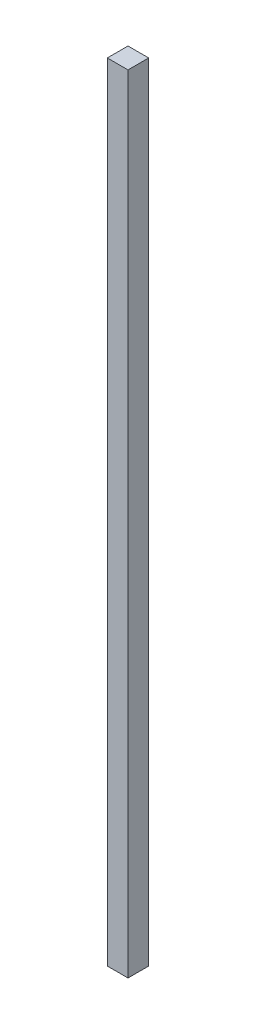
from build123d import *

# Parameters (mm, degrees)
SKETCH_1_W      = 50
SKETCH_1_H      = 50
EXTRUDE_1_DEPTH = 1900


with BuildPart() as part:
    # Эскиз1 → Бобышка-Вытянуть1 (new body)
    with BuildSketch(Plane(origin=(0, 0, 0), x_dir=(1, 0, 0), z_dir=(0, 1, 0))):
        Rectangle(SKETCH_1_W, SKETCH_1_H)
    extrude(amount=EXTRUDE_1_DEPTH)


solid = part.part
